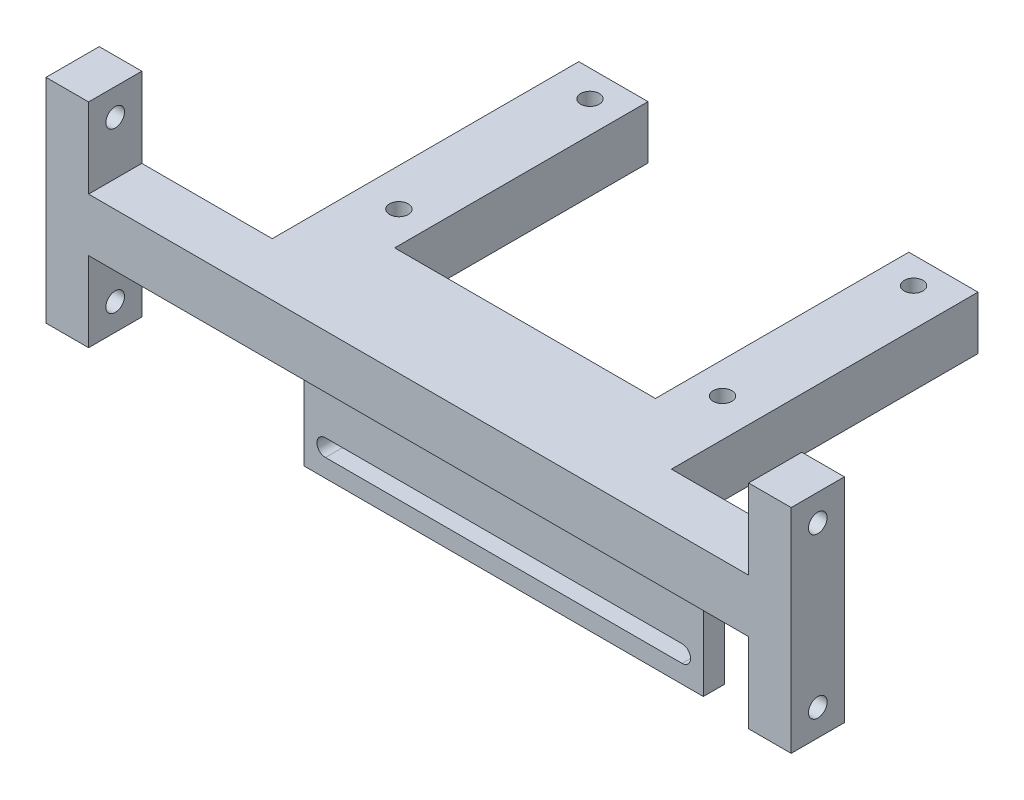
from build123d import *

# Parameters (mm, degrees)
SKETCH_1_W               = 140
SKETCH_1_H               = 10
EXTRUDE_1_DEPTH          = 80
SKETCH_2_W               = 32.5
SKETCH_2_H               = 70
CUT_EXTRUDE_1_DEPTH      = 107.77078252
SKETCH_4_W               = 55
SKETCH_4_H               = 10
CUT_EXTRUDE_2_DEPTH      = 60
SKETCH_5_W               = 8
SKETCH_5_H               = 40
EXTRUDE_2_DEPTH          = 10
CUT_EXTRUDE_START        = -12.4
SKETCH_6_W               = 10
SKETCH_6_H               = 10
CUT_EXTRUDE_3_DEPTH      = 12.4
SKETCH_7_W               = 75
SKETCH_7_H               = 4
EXTRUDE_3_DEPTH          = 30
CUT_EXTRUDE_4_DEPTH      = 27
CUT_EXTRUDE_5_DEPTH      = 159.268758762
CUT_EXTRUDE_5_DEPTH_BACK = 159.268758762
SKETCH_9_R               = 1.75
CUT_EXTRUDE_6_DEPTH      = 114.578166916
CUT_EXTRUDE_6_DEPTH_BACK = 114.578166916
SKETCH_10_R              = 1.75
SKETCH_11_W              = 47.6
SKETCH_11_H              = 10
EXTRUDE_4_DEPTH          = 3
SKETCH_12_W              = 47.6
SKETCH_12_H              = 10
EXTRUDE_5_DEPTH          = 3


with BuildPart() as part:
    # 草图1 → 凸台-拉伸1 (new body)
    with BuildSketch(Plane.XY):
        Rectangle(SKETCH_1_W, SKETCH_1_H)
    extrude(amount=EXTRUDE_1_DEPTH)

    # 草图2 → 切除-拉伸1 (cut, through all)
    with BuildSketch(Plane(origin=(0, 5, 0), x_dir=(1, 0, 0), z_dir=(0, 1, 0))):
        with Locations((-53.75, -35)):
            Rectangle(SKETCH_2_W, SKETCH_2_H)
        with Locations((53.75, -35)):
            Rectangle(SKETCH_2_W, SKETCH_2_H)
    extrude(amount=-CUT_EXTRUDE_1_DEPTH, mode=Mode.SUBTRACT)

    # 草图4 → 切除-拉伸2 (cut)
    with BuildSketch(Plane(origin=(0, 0, 0), x_dir=(-1, 0, 0), z_dir=(0, 0, -1))):
        Rectangle(SKETCH_4_W, SKETCH_4_H)
    extrude(amount=-CUT_EXTRUDE_2_DEPTH, mode=Mode.SUBTRACT)

    # 草图5 → 凸台-拉伸2 (add)
    with BuildSketch(Plane(origin=(0, 0, 70), x_dir=(-1, 0, 0), z_dir=(0, 0, -1))):
        with Locations((-66, 0)):
            Rectangle(SKETCH_5_W, SKETCH_5_H)
        with Locations((66, 0)):
            Rectangle(SKETCH_5_W, SKETCH_5_H)
    extrude(amount=-EXTRUDE_2_DEPTH)

    # 草图6 → 切除-拉伸3 (cut)
    with BuildSketch(Plane(origin=(0, 0, 0), x_dir=(-1, 0, 0), z_dir=(0, 0, -1)).offset(CUT_EXTRUDE_START)):
        with Locations((32.5, 0)):
            Rectangle(SKETCH_6_W, SKETCH_6_H)
        with Locations((-32.5, 0)):
            Rectangle(SKETCH_6_W, SKETCH_6_H)
    extrude(amount=CUT_EXTRUDE_3_DEPTH, mode=Mode.SUBTRACT)

    # 草图7 → 凸台-拉伸3 (add)
    with BuildSketch(Plane.XZ.offset(5)):
        with Locations((0, 62)):
            Rectangle(SKETCH_7_W, SKETCH_7_H)
    extrude(amount=EXTRUDE_3_DEPTH)

    # 草图8 → 切除-拉伸4 (cut)
    with BuildSketch(Plane(origin=(0, 0, 60), x_dir=(-1, 0, 0), z_dir=(0, 0, -1))):
        with BuildLine():
            Line((-33.5, -28.4), (33.5, -28.4))
            ThreePointArc((33.5, -28.4), (35.1, -30), (33.5, -31.6))
            Line((33.5, -31.6), (-33.5, -31.6))
            ThreePointArc((-33.5, -31.6), (-35.1, -30), (-33.5, -28.4))
        make_face()
    extrude(amount=-CUT_EXTRUDE_4_DEPTH, mode=Mode.SUBTRACT)

    # 草图9 → 切除-拉伸5 (cut, two sides: drawn at the far end of the back side and taken through both)
    with BuildSketch(Plane(origin=(-62, 0, 0), x_dir=(0, 0, -1), z_dir=(1, 0, 0)).offset(-CUT_EXTRUDE_5_DEPTH_BACK)):
        with Locations((-75, 15)):
            Circle(SKETCH_9_R)
        with Locations((-75, -15)):
            Circle(SKETCH_9_R)
    extrude(amount=CUT_EXTRUDE_5_DEPTH + CUT_EXTRUDE_5_DEPTH_BACK, mode=Mode.SUBTRACT)

    # 草图10 → 切除-拉伸6 (cut, two sides: drawn at the far end of the back side and taken through both)
    with BuildSketch(Plane(origin=(0, 5, 0), x_dir=(1, 0, 0), z_dir=(0, 1, 0)).offset(-CUT_EXTRUDE_6_DEPTH_BACK)):
        with Locations(Location((30.4, -53.3, 0), (0, 0, 270))):
            Circle(SKETCH_10_R)
        with Locations(Location((30.4, -17.4, 0), (0, 0, 270))):
            Circle(SKETCH_10_R)
        with Locations(Location((-30.4, -17.4, 0), (0, 0, 270))):
            Circle(SKETCH_10_R)
        with Locations(Location((-30.4, -53.3, 0), (0, 0, 270))):
            Circle(SKETCH_10_R)
    extrude(amount=CUT_EXTRUDE_6_DEPTH + CUT_EXTRUDE_6_DEPTH_BACK, mode=Mode.SUBTRACT)

    # 草图11 → 凸台-拉伸4 (add)
    with BuildSketch(Plane.ZY.offset(-27.5)):
        with Locations((36.2, 0)):
            Rectangle(SKETCH_11_W, SKETCH_11_H)
    extrude(amount=EXTRUDE_4_DEPTH)

    # 草图12 → 凸台-拉伸5 (add)
    with BuildSketch(Plane(origin=(-27.5, 0, 0), x_dir=(0, 0, -1), z_dir=(1, 0, 0))):
        with Locations((-36.2, 0)):
            Rectangle(SKETCH_12_W, SKETCH_12_H)
    extrude(amount=EXTRUDE_5_DEPTH)


solid = part.part
